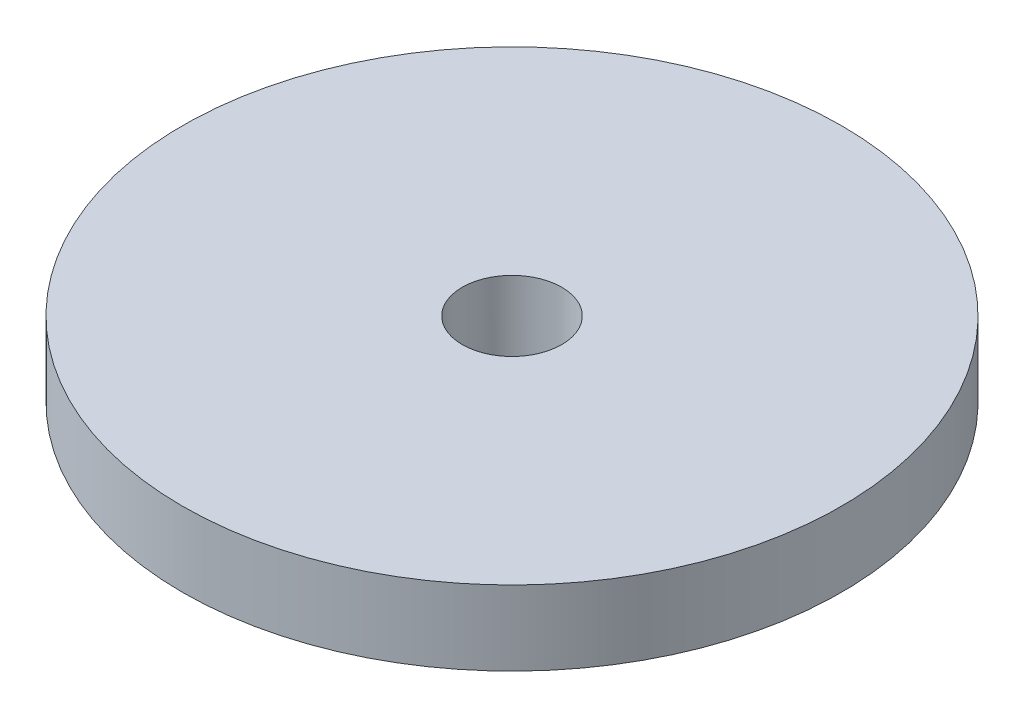
from build123d import *

# Parameters (mm, degrees)
CUT_EXTRUDE1_DEPTH      = 61.268150793
CUT_EXTRUDE1_DEPTH_BACK = 61.268150793
SKETCH4_R               = 4


with BuildPart() as part:
    # Sketch1 → Revolve1 (revolve)
    with BuildSketch(Plane.XY, mode=Mode.PRIVATE) as revolve1_sk:
        Polygon((0, 0), (0, 6), (-22.5, 6), (-22.5, 11), (-26.5, 11), (-26.5, -3), (-13, -3), (-13, 0), align=None)
    revolve(revolve1_sk.sketch.rotate(Axis((-26.5, 11, 0), (0, -1, 0)), 90), axis=Axis((-26.5, 11, 0), (0, -1, 0)))

    # Sketch4 → Cut-Extrude1 (cut, two sides: drawn at the far end of the back side and taken through both)
    with BuildSketch(Plane(origin=(0, 0, 0), x_dir=(1, 0, 0), z_dir=(0, 1, 0)).offset(-CUT_EXTRUDE1_DEPTH_BACK)):
        with Locations(Location((-26.5, 0, 0), (0, 0, 270))):
            Circle(SKETCH4_R)
    extrude(amount=CUT_EXTRUDE1_DEPTH + CUT_EXTRUDE1_DEPTH_BACK, mode=Mode.SUBTRACT)


solid = part.part
